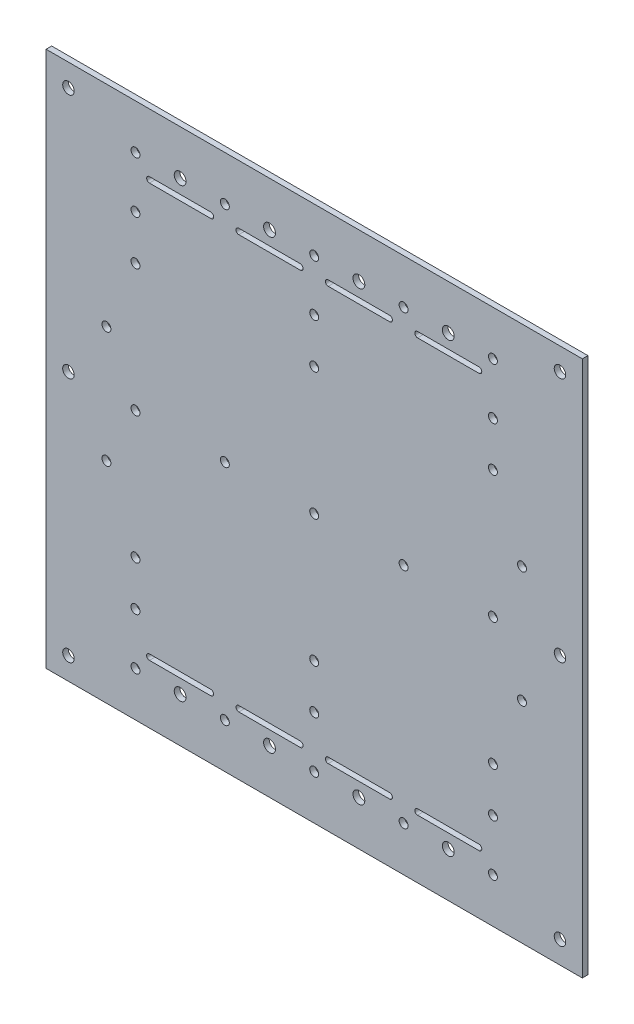
from build123d import *

# Parameters (mm, degrees)
SKETCH1_W           = 304.8
SKETCH1_H           = 304.8
SKETCH1_R           = 3.3655
SKETCH1_R_2         = 2.54
SKETCH1_R_3         = 3.2639
BOSS_EXTRUDE1_DEPTH = 3.175


with BuildPart() as part:
    # Sketch1 → Boss-Extrude1 (new body)
    with BuildSketch(Plane.XY):
        Rectangle(SKETCH1_W, SKETCH1_H)
        with Locations((-76.2, 127)):
            Circle(SKETCH1_R, mode=Mode.SUBTRACT)
        with Locations((-25.4, 127)):
            Circle(SKETCH1_R, mode=Mode.SUBTRACT)
        with Locations((25.4, 127)):
            Circle(SKETCH1_R, mode=Mode.SUBTRACT)
        with Locations((76.2, 127)):
            Circle(SKETCH1_R, mode=Mode.SUBTRACT)
        with Locations((-101.6, 0)):
            Circle(SKETCH1_R_2, mode=Mode.SUBTRACT)
        with Locations((-50.8, 0)):
            Circle(SKETCH1_R_2, mode=Mode.SUBTRACT)
        Circle(SKETCH1_R_2, mode=Mode.SUBTRACT)
        with Locations((101.6, 0)):
            Circle(SKETCH1_R_2, mode=Mode.SUBTRACT)
        with Locations((50.8, 0)):
            Circle(SKETCH1_R_2, mode=Mode.SUBTRACT)
        with Locations((-50.8, 127)):
            Circle(SKETCH1_R_2, mode=Mode.SUBTRACT)
        with Locations((0, 127)):
            Circle(SKETCH1_R_2, mode=Mode.SUBTRACT)
        with Locations((50.8, 127)):
            Circle(SKETCH1_R_2, mode=Mode.SUBTRACT)
        with Locations((-101.6, 72.39)):
            Circle(SKETCH1_R_2, mode=Mode.SUBTRACT)
        with Locations((0, 72.39)):
            Circle(SKETCH1_R_2, mode=Mode.SUBTRACT)
        with Locations((101.6, 72.39)):
            Circle(SKETCH1_R_2, mode=Mode.SUBTRACT)
        with Locations((-101.6, -72.39)):
            Circle(SKETCH1_R_2, mode=Mode.SUBTRACT)
        with Locations((0, -72.39)):
            Circle(SKETCH1_R_2, mode=Mode.SUBTRACT)
        with Locations((101.6, -72.39)):
            Circle(SKETCH1_R_2, mode=Mode.SUBTRACT)
        with Locations((-76.2, -127)):
            Circle(SKETCH1_R, mode=Mode.SUBTRACT)
        with Locations((-25.4, -127)):
            Circle(SKETCH1_R, mode=Mode.SUBTRACT)
        with Locations((25.4, -127)):
            Circle(SKETCH1_R, mode=Mode.SUBTRACT)
        with Locations((76.2, -127)):
            Circle(SKETCH1_R, mode=Mode.SUBTRACT)
        with Locations((50.8, -127)):
            Circle(SKETCH1_R_2, mode=Mode.SUBTRACT)
        with Locations((0, -127)):
            Circle(SKETCH1_R_2, mode=Mode.SUBTRACT)
        with Locations((-50.8, -127)):
            Circle(SKETCH1_R_2, mode=Mode.SUBTRACT)
        with Locations((-101.6, 97.79)):
            Circle(SKETCH1_R_2, mode=Mode.SUBTRACT)
        with Locations((0, 97.79)):
            Circle(SKETCH1_R_2, mode=Mode.SUBTRACT)
        with Locations((101.6, 97.79)):
            Circle(SKETCH1_R_2, mode=Mode.SUBTRACT)
        with Locations((101.6, 127)):
            Circle(SKETCH1_R_2, mode=Mode.SUBTRACT)
        with Locations((-101.6, 127)):
            Circle(SKETCH1_R_2, mode=Mode.SUBTRACT)
        with Locations((-118.11, 33.02)):
            Circle(SKETCH1_R_2, mode=Mode.SUBTRACT)
        with Locations((-101.6, -127)):
            Circle(SKETCH1_R_2, mode=Mode.SUBTRACT)
        with Locations((101.6, -127)):
            Circle(SKETCH1_R_2, mode=Mode.SUBTRACT)
        with Locations((101.6, -97.79)):
            Circle(SKETCH1_R_2, mode=Mode.SUBTRACT)
        with Locations((0, -97.79)):
            Circle(SKETCH1_R_2, mode=Mode.SUBTRACT)
        with Locations((-101.6, -97.79)):
            Circle(SKETCH1_R_2, mode=Mode.SUBTRACT)
        with Locations((-118.11, -33.02)):
            Circle(SKETCH1_R_2, mode=Mode.SUBTRACT)
        with Locations((-139.7, 139.7)):
            Circle(SKETCH1_R_3, mode=Mode.SUBTRACT)
        with Locations((-139.7, 0)):
            Circle(SKETCH1_R_3, mode=Mode.SUBTRACT)
        with Locations((-139.7, -139.7)):
            Circle(SKETCH1_R_3, mode=Mode.SUBTRACT)
        with Locations((139.7, -139.7)):
            Circle(SKETCH1_R_3, mode=Mode.SUBTRACT)
        with Locations((139.7, 0)):
            Circle(SKETCH1_R_3, mode=Mode.SUBTRACT)
        with Locations((139.7, 139.7)):
            Circle(SKETCH1_R_3, mode=Mode.SUBTRACT)
        with Locations((118.11, 33.02)):
            Circle(SKETCH1_R_2, mode=Mode.SUBTRACT)
        with Locations((118.11, -33.02)):
            Circle(SKETCH1_R_2, mode=Mode.SUBTRACT)
        with BuildLine():
            Line((-93.6625, 119.0625), (-58.7375, 119.0625))
            ThreePointArc((-58.7375, 119.0625), (-57.15, 117.475), (-58.7375, 115.8875))
            Line((-58.7375, 115.8875), (-93.6625, 115.8875))
            ThreePointArc((-93.6625, 115.8875), (-95.25, 117.475), (-93.6625, 119.0625))
        make_face(mode=Mode.SUBTRACT)
        with BuildLine():
            Line((-7.9375, 119.0625), (-42.8625, 119.0625))
            ThreePointArc((-42.8625, 119.0625), (-44.45, 117.475), (-42.8625, 115.8875))
            Line((-42.8625, 115.8875), (-7.9375, 115.8875))
            ThreePointArc((-7.9375, 115.8875), (-6.35, 117.475), (-7.9375, 119.0625))
        make_face(mode=Mode.SUBTRACT)
        with BuildLine():
            Line((7.9375, 119.0625), (42.8625, 119.0625))
            ThreePointArc((42.8625, 119.0625), (44.45, 117.475), (42.8625, 115.8875))
            Line((42.8625, 115.8875), (7.9375, 115.8875))
            ThreePointArc((7.9375, 115.8875), (6.35, 117.475), (7.9375, 119.0625))
        make_face(mode=Mode.SUBTRACT)
        with BuildLine():
            Line((93.6625, 119.0625), (58.7375, 119.0625))
            ThreePointArc((58.7375, 119.0625), (57.15, 117.475), (58.7375, 115.8875))
            Line((58.7375, 115.8875), (93.6625, 115.8875))
            ThreePointArc((93.6625, 115.8875), (95.25, 117.475), (93.6625, 119.0625))
        make_face(mode=Mode.SUBTRACT)
        with BuildLine():
            Line((93.6625, -119.0625), (58.7375, -119.0625))
            ThreePointArc((58.7375, -119.0625), (57.15, -117.475), (58.7375, -115.8875))
            Line((58.7375, -115.8875), (93.6625, -115.8875))
            ThreePointArc((93.6625, -115.8875), (95.25, -117.475), (93.6625, -119.0625))
        make_face(mode=Mode.SUBTRACT)
        with BuildLine():
            Line((7.9375, -119.0625), (42.8625, -119.0625))
            ThreePointArc((42.8625, -119.0625), (44.45, -117.475), (42.8625, -115.8875))
            Line((42.8625, -115.8875), (7.9375, -115.8875))
            ThreePointArc((7.9375, -115.8875), (6.35, -117.475), (7.9375, -119.0625))
        make_face(mode=Mode.SUBTRACT)
        with BuildLine():
            Line((-7.9375, -119.0625), (-42.8625, -119.0625))
            ThreePointArc((-42.8625, -119.0625), (-44.45, -117.475), (-42.8625, -115.8875))
            Line((-42.8625, -115.8875), (-7.9375, -115.8875))
            ThreePointArc((-7.9375, -115.8875), (-6.35, -117.475), (-7.9375, -119.0625))
        make_face(mode=Mode.SUBTRACT)
        with BuildLine():
            Line((-93.6625, -119.0625), (-58.7375, -119.0625))
            ThreePointArc((-58.7375, -119.0625), (-57.15, -117.475), (-58.7375, -115.8875))
            Line((-58.7375, -115.8875), (-93.6625, -115.8875))
            ThreePointArc((-93.6625, -115.8875), (-95.25, -117.475), (-93.6625, -119.0625))
        make_face(mode=Mode.SUBTRACT)
    extrude(amount=BOSS_EXTRUDE1_DEPTH)


solid = part.part
